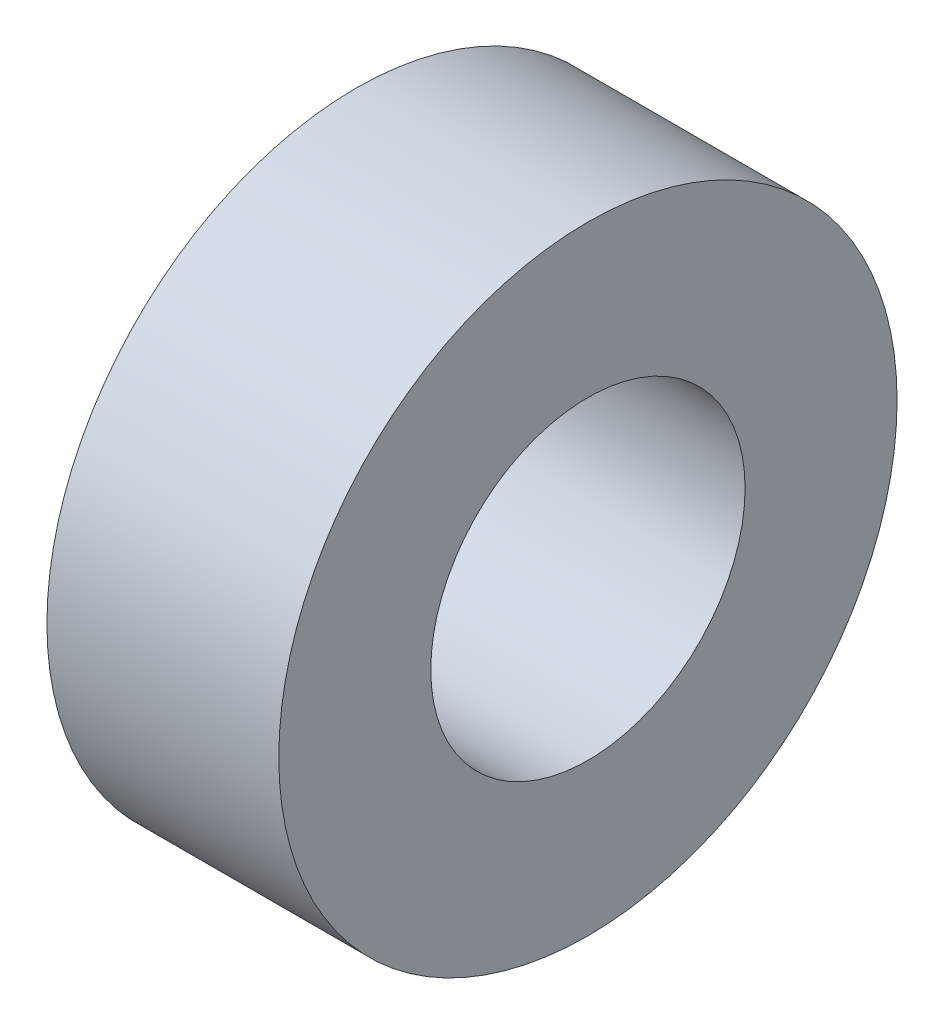
from build123d import *

# Parameters (mm, degrees)
PART_RING_OUTSIDE_SKETCH_R = 6
PART_RING_OUTSIDE_DEPTH    = 4.5
PART_RING_BORE_SKETCH_R    = 3.05
PART_RING_BORE_DEPTH       = 4.7


with BuildPart() as part:
    # Part ring outside sketch → Part ring outside (new body)
    with BuildSketch(Plane(origin=(15, 0, 0), x_dir=(0, 0, -1), z_dir=(1, 0, 0))):
        with Locations((19.5, -29)):
            Circle(PART_RING_OUTSIDE_SKETCH_R)
    extrude(amount=PART_RING_OUTSIDE_DEPTH)

    # Part ring bore sketch → Part ring bore (cut)
    with BuildSketch(Plane(origin=(14.9, 0, 0), x_dir=(0, 0, -1), z_dir=(1, 0, 0))):
        with Locations((19.5, -29)):
            Circle(PART_RING_BORE_SKETCH_R)
    extrude(amount=PART_RING_BORE_DEPTH, mode=Mode.SUBTRACT)


solid = part.part
